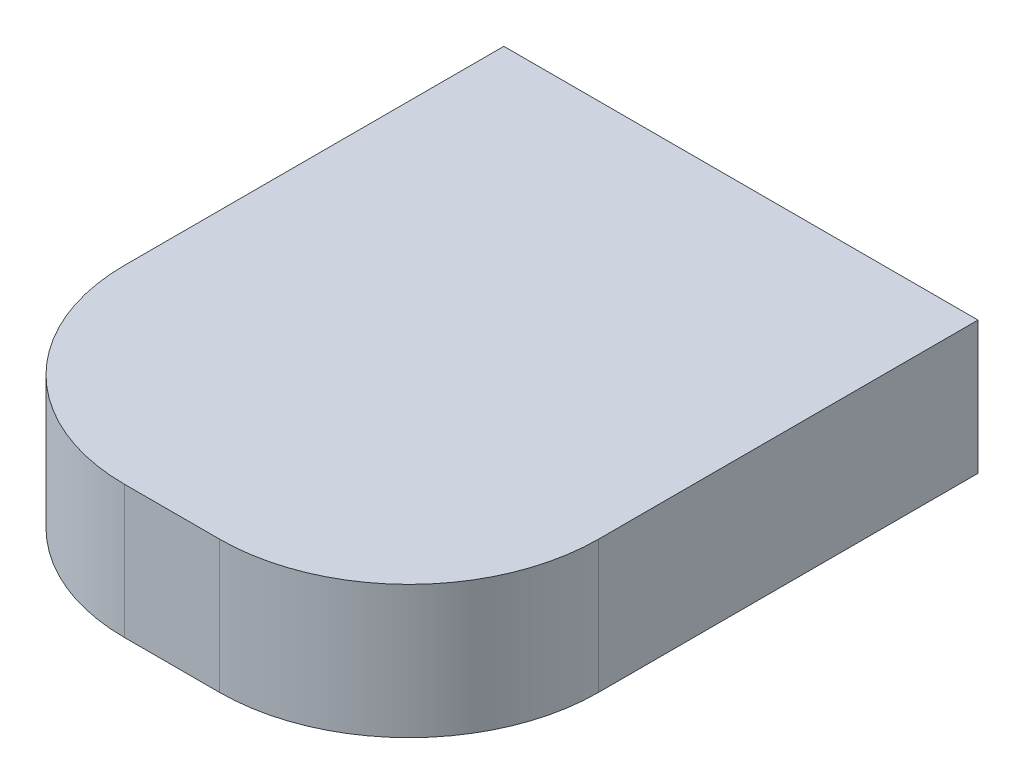
from build123d import *

# Parameters (mm, degrees)
SKETCH1_W           = 25
SKETCH1_H           = 30
BOSS_EXTRUDE1_DEPTH = 7
SKETCH2_R           = 10
CUT_EXTRUDE1_DEPTH  = 3
FILLET1_R           = 10
FILLET2_R           = 10


with BuildPart() as part:
    # Sketch1 → Boss-Extrude1 (new body)
    with BuildSketch(Plane(origin=(0, 0, 0), x_dir=(1, 0, 0), z_dir=(0, 1, 0))):
        Rectangle(SKETCH1_W, SKETCH1_H)
    extrude(amount=BOSS_EXTRUDE1_DEPTH)

    # Sketch2 → Cut-Extrude1 (cut)
    with BuildSketch(Plane(origin=(0, 0, 0), x_dir=(1, 0, 0), z_dir=(0, 1, 0))):
        with Locations(Location((0, -3, 0), (0, 0, 270))):
            Circle(SKETCH2_R)
    extrude(amount=CUT_EXTRUDE1_DEPTH, mode=Mode.SUBTRACT)

    # Fillet1
    fillet1_edges = [part.edges().sort_by_distance(p)[0] for p in [
        (-12.5, 3.5, 15),
    ]]
    fillet(fillet1_edges, radius=FILLET1_R)

    # Fillet2
    fillet2_edges = [part.edges().sort_by_distance(p)[0] for p in [
        (12.5, 3.5, 15),
    ]]
    fillet(fillet2_edges, radius=FILLET2_R)


solid = part.part
